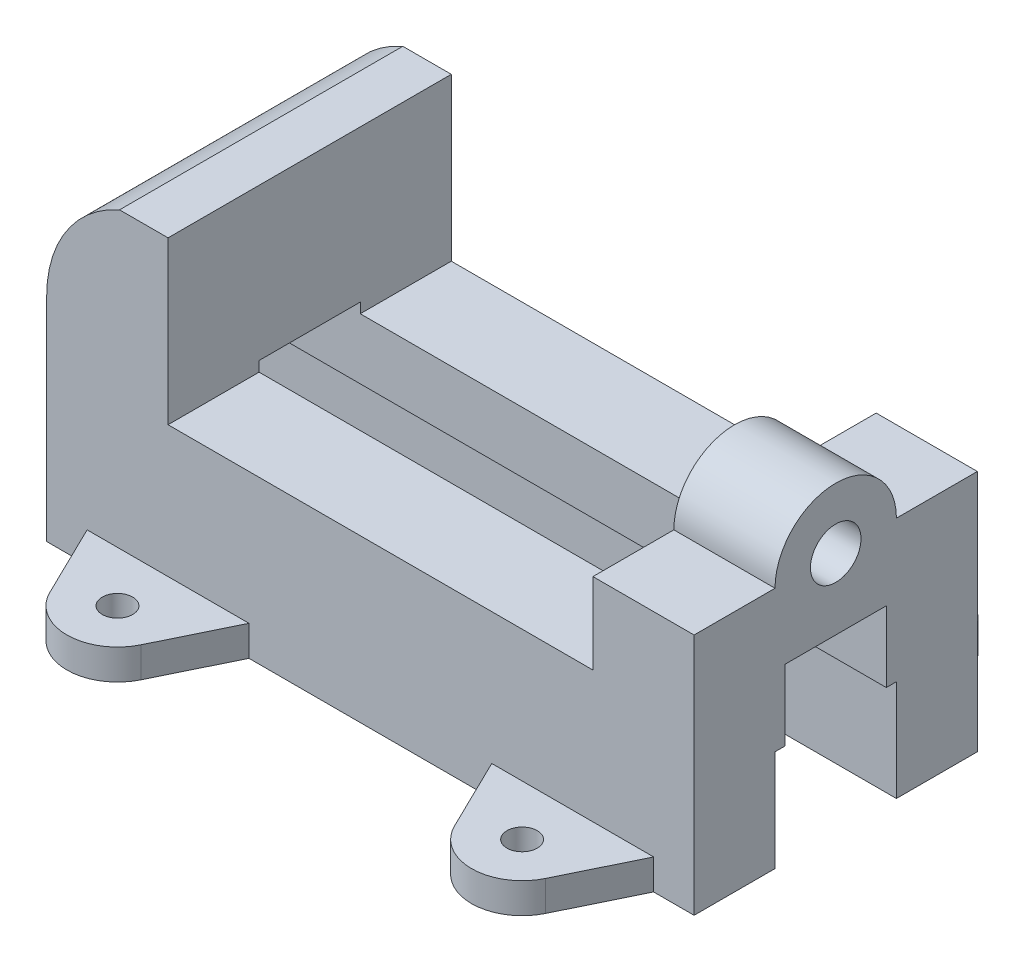
from build123d import *

# Parameters (mm, degrees)
BOSS_EXTRUDE1_DEPTH = 88.9
BOSS_EXTRUDE2_DEPTH = 31.75
SKETCH3_R           = 7.9375
CUT_EXTRUDE1_DEPTH  = 31.75
CUT_EXTRUDE2_DEPTH  = 244.959033446
SKETCH5_W           = 50.8
SKETCH5_H           = 9.525
BOSS_EXTRUDE3_DEPTH = 15.875
BOSS_EXTRUDE4_DEPTH = 9.525
CUT_EXTRUDE3_DEPTH  = 9.525
BOSS_EXTRUDE5_DEPTH = 9.525
CUT_EXTRUDE4_DEPTH  = 9.525
SKETCH11_R          = 4.7625
CUT_EXTRUDE5_DEPTH  = 241.148403336
SKETCH12_R          = 4.7625
CUT_EXTRUDE6_DEPTH  = 241.148403336
SKETCH13_W          = 50.8
SKETCH13_H          = 9.525
BOSS_EXTRUDE6_DEPTH = 15.875
BOSS_EXTRUDE7_DEPTH = 9.525
CUT_EXTRUDE7_DEPTH  = 9.525
BOSS_EXTRUDE8_DEPTH = 9.525
CUT_EXTRUDE8_DEPTH  = 9.525
SKETCH18_R          = 4.7625
CUT_EXTRUDE9_DEPTH  = 254.622688506


with BuildPart() as part:
    # Sketch1 → Boss-Extrude1 (new body)
    with BuildSketch(Plane.XY):
        with BuildLine():
            Line((0, 0), (0, 66.675))
            ThreePointArc((0, 66.675), (6.227207921, 87.549269451), (22.873234913, 101.6))
            Line((22.873234913, 101.6), (38.1, 101.6))
            Line((38.1, 101.6), (38.1, 50.8))
            Line((38.1, 50.8), (171.45, 50.8))
            Line((171.45, 50.8), (171.45, 76.2))
            Line((171.45, 76.2), (203.2, 76.2))
            Line((203.2, 76.2), (203.2, 0))
            Line((203.2, 0), (0, 0))
        make_face()
    extrude(amount=-BOSS_EXTRUDE1_DEPTH)

    # Sketch2 → Boss-Extrude2 (add)
    with BuildSketch(Plane(origin=(203.2, 0, 0), x_dir=(0, 0, -1), z_dir=(1, 0, 0))):
        with BuildLine():
            Line((25.4, 76.2), (63.5, 76.2))
            ThreePointArc((63.5, 76.2), (44.45, 95.25), (25.4, 76.2))
        make_face()
    extrude(amount=-BOSS_EXTRUDE2_DEPTH)

    # Sketch3 → Cut-Extrude1 (cut)
    with BuildSketch(Plane(origin=(203.2, 0, 0), x_dir=(0, 0, -1), z_dir=(1, 0, 0))):
        with Locations((44.45, 76.2)):
            Circle(SKETCH3_R)
    extrude(amount=-CUT_EXTRUDE1_DEPTH, mode=Mode.SUBTRACT)

    # Sketch4 → Cut-Extrude2 (cut, through all)
    with BuildSketch(Plane(origin=(203.2, 0, 0), x_dir=(0, 0, -1), z_dir=(1, 0, 0))):
        Polygon((25.4, 31.75), (25.4, 0), (63.5, 0), (63.5, 31.75), (60.325, 31.75), (60.325, 53.975), (28.575, 53.975), (28.575, 31.75), align=None)
    extrude(amount=-CUT_EXTRUDE2_DEPTH, mode=Mode.SUBTRACT)

    # Sketch5 → Boss-Extrude3 (add)
    with BuildSketch(Plane.XY):
        with Locations((38.1, 4.7625)):
            Rectangle(SKETCH5_W, SKETCH5_H)
        with Locations((165.1, 4.7625)):
            Rectangle(SKETCH5_W, SKETCH5_H)
    extrude(amount=BOSS_EXTRUDE3_DEPTH)

    # Sketch7 → Boss-Extrude4 (add)
    with BuildSketch(Plane(origin=(0, 9.525, 0), x_dir=(1, 0, 0), z_dir=(0, 1, 0))):
        with BuildLine():
            Line((12.7, 0), (23.830337079, -22.831460674))
            ThreePointArc((23.830337079, -22.831460674), (38.1, -31.75), (52.369662921, -22.831460674))
            Line((52.369662921, -22.831460674), (63.5, 0))
            Line((63.5, 0), (12.7, 0))
        make_face()
    extrude(amount=-BOSS_EXTRUDE4_DEPTH)

    # Sketch8 → Cut-Extrude3 (cut)
    with BuildSketch(Plane(origin=(0, 9.525, 0), x_dir=(1, 0, 0), z_dir=(0, 1, 0))):
        Polygon((12.7, 0), (20.4390625, -15.875), (12.7, -15.875), align=None)
        Polygon((55.7609375, -15.875), (63.5, 0), (63.5, -15.875), align=None)
    extrude(amount=-CUT_EXTRUDE3_DEPTH, mode=Mode.SUBTRACT)

    # Sketch9 → Boss-Extrude5 (add)
    with BuildSketch(Plane(origin=(0, 9.525, 0), x_dir=(1, 0, 0), z_dir=(0, 1, 0))):
        with BuildLine():
            Line((139.7, 0), (150.830337079, -22.831460674))
            ThreePointArc((150.830337079, -22.831460674), (165.1, -31.75), (179.369662921, -22.831460674))
            Line((179.369662921, -22.831460674), (190.5, 0))
            Line((190.5, 0), (139.7, 0))
        make_face()
    extrude(amount=-BOSS_EXTRUDE5_DEPTH)

    # Sketch10 → Cut-Extrude4 (cut)
    with BuildSketch(Plane(origin=(0, 9.525, 0), x_dir=(1, 0, 0), z_dir=(0, 1, 0))):
        Polygon((147.4390625, -15.875), (139.7, 0), (139.7, -15.875), align=None)
        Polygon((190.5, 0), (182.7609375, -15.875), (190.5, -15.875), align=None)
    extrude(amount=-CUT_EXTRUDE4_DEPTH, mode=Mode.SUBTRACT)

    # Sketch11 → Cut-Extrude5 (cut, through all)
    with BuildSketch(Plane(origin=(0, 9.525, 0), x_dir=(1, 0, 0), z_dir=(0, 1, 0))):
        with Locations(Location((38.1, -15.875, 0), (0, 0, 270))):
            Circle(SKETCH11_R)
    extrude(amount=-CUT_EXTRUDE5_DEPTH, mode=Mode.SUBTRACT)

    # Sketch12 → Cut-Extrude6 (cut, through all)
    with BuildSketch(Plane(origin=(0, 9.525, 0), x_dir=(1, 0, 0), z_dir=(0, 1, 0))):
        with Locations(Location((165.1, -15.875, 0), (0, 0, 180))):
            Circle(SKETCH12_R)
    extrude(amount=-CUT_EXTRUDE6_DEPTH, mode=Mode.SUBTRACT)

    # Sketch13 → Boss-Extrude6 (add)
    with BuildSketch(Plane(origin=(0, 0, -88.9), x_dir=(-1, 0, 0), z_dir=(0, 0, -1))):
        with Locations((-165.1, 4.7625)):
            Rectangle(SKETCH13_W, SKETCH13_H)
        with Locations((-38.1, 4.7625)):
            Rectangle(SKETCH13_W, SKETCH13_H)
    extrude(amount=BOSS_EXTRUDE6_DEPTH)

    # Sketch14 → Boss-Extrude7 (add)
    with BuildSketch(Plane(origin=(0, 9.525, 0), x_dir=(1, 0, 0), z_dir=(0, 1, 0))):
        with BuildLine():
            Line((190.5, 88.9), (179.369662921, 111.731460674))
            ThreePointArc((179.369662921, 111.731460674), (165.1, 120.65), (150.830337079, 111.731460674))
            Line((150.830337079, 111.731460674), (139.7, 88.9))
            Line((139.7, 88.9), (190.5, 88.9))
        make_face()
    extrude(amount=-BOSS_EXTRUDE7_DEPTH)

    # Sketch15 → Cut-Extrude7 (cut)
    with BuildSketch(Plane(origin=(0, 9.525, 0), x_dir=(1, 0, 0), z_dir=(0, 1, 0))):
        Polygon((182.7609375, 104.775), (190.5, 88.9), (190.5, 104.775), align=None)
        Polygon((147.4390625, 104.775), (139.7, 88.9), (139.7, 104.775), align=None)
    extrude(amount=-CUT_EXTRUDE7_DEPTH, mode=Mode.SUBTRACT)

    # Sketch16 → Boss-Extrude8 (add)
    with BuildSketch(Plane(origin=(0, 9.525, 0), x_dir=(1, 0, 0), z_dir=(0, 1, 0))):
        with BuildLine():
            Line((63.5, 88.9), (52.369662921, 111.731460674))
            ThreePointArc((52.369662921, 111.731460674), (38.1, 120.65), (23.830337079, 111.731460674))
            Line((23.830337079, 111.731460674), (12.7, 88.9))
            Line((12.7, 88.9), (63.5, 88.9))
        make_face()
    extrude(amount=-BOSS_EXTRUDE8_DEPTH)

    # Sketch17 → Cut-Extrude8 (cut)
    with BuildSketch(Plane(origin=(0, 9.525, 0), x_dir=(1, 0, 0), z_dir=(0, 1, 0))):
        Polygon((63.5, 88.9), (55.7609375, 104.775), (63.5, 104.775), align=None)
        Polygon((12.7, 88.9), (12.7, 104.775), (20.4390625, 104.775), align=None)
    extrude(amount=-CUT_EXTRUDE8_DEPTH, mode=Mode.SUBTRACT)

    # Sketch18 → Cut-Extrude9 (cut, through all)
    with BuildSketch(Plane(origin=(0, 9.525, 0), x_dir=(1, 0, 0), z_dir=(0, 1, 0))):
        with Locations(Location((165.1, 104.775, 0), (0, 0, 270))):
            Circle(SKETCH18_R)
        with Locations(Location((38.1, 104.775, 0), (0, 0, 270))):
            Circle(SKETCH18_R)
    extrude(amount=-CUT_EXTRUDE9_DEPTH, mode=Mode.SUBTRACT)


solid = part.part
